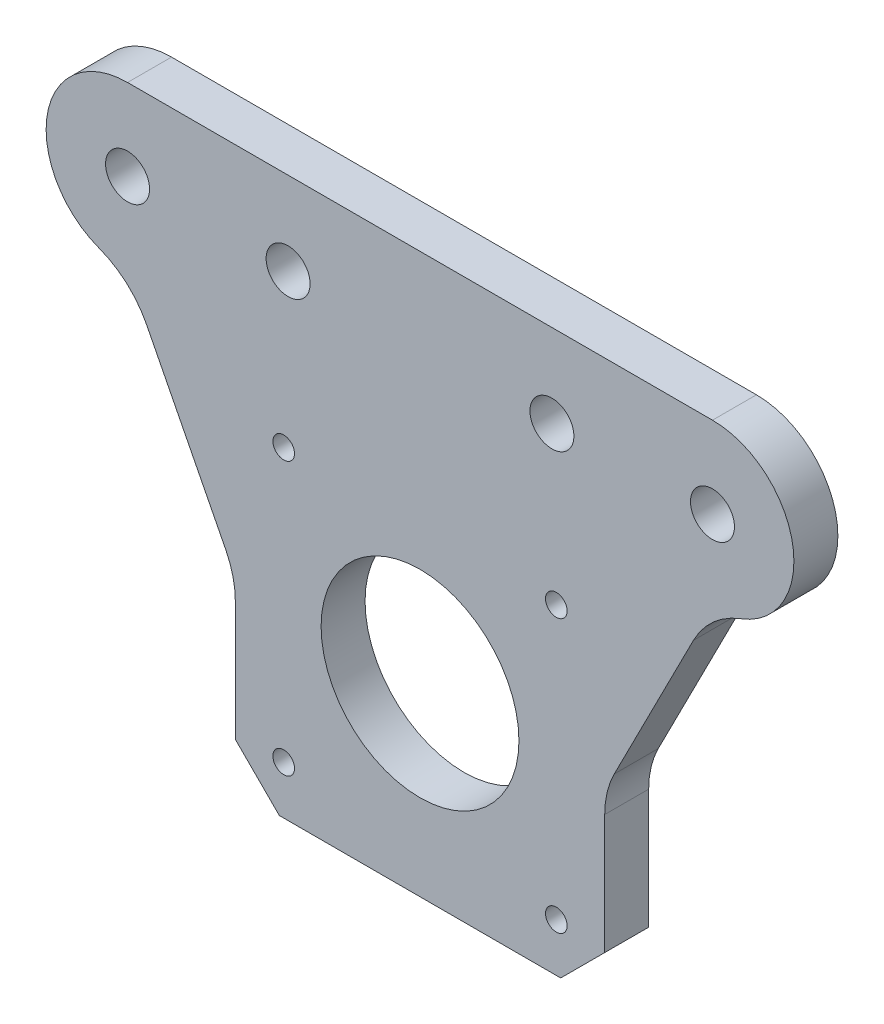
from build123d import *

# Parameters (mm, degrees)
ESQUISSE1_R             = 7.48734248
ESQUISSE1_R_2           = 2.5
BOSS_EXTRU_1_DEPTH      = 5
ESQUISSE2_R             = 1.2295
ENL_V_MAT_EXTRU_1_DEPTH = 5
CONG_2_R                = 10
CONG_3_R                = 10
ESQUISSE3_R             = 11.25
ENL_V_MAT_EXTRU_2_DEPTH = 10
CHANFREIN1_SIZE         = 5


with BuildPart() as part:
    # Esquisse1 → Boss.-Extru.1 (new body)
    with BuildSketch(Plane.XY):
        with BuildLine():
            Line((-33.258331918, 42.564920159), (33.258331918, 42.564920159))
            ThreePointArc((33.258331918, 42.564920159), (42.517839876, 33.305412201), (33.258331918, 24.045904244))
            Line((33.258331918, 24.045904244), (21, 0))
            Line((21, 0), (21, -21))
            Line((21, -21), (-21, -21))
            Line((-21, -21), (-21, 0))
            Line((-21, 0), (-33.258331918, 24.045904244))
            ThreePointArc((-33.258331918, 24.045904244), (-42.517839876, 33.305412201), (-33.258331918, 42.564920159))
        make_face()
        Circle(ESQUISSE1_R, mode=Mode.SUBTRACT)
        with Locations((-33.258331918, 33.306233754)):
            Circle(ESQUISSE1_R_2, mode=Mode.SUBTRACT)
        with Locations(Location((33.258331918, 33.306233754, 0), (0, 0, 180))):
            Circle(ESQUISSE1_R_2, mode=Mode.SUBTRACT)
        with Locations((-15, 33.108389008)):
            Circle(ESQUISSE1_R_2, mode=Mode.SUBTRACT)
        with Locations(Location((15, 33.108389008, 0), (0, 0, 180))):
            Circle(ESQUISSE1_R_2, mode=Mode.SUBTRACT)
    extrude(amount=BOSS_EXTRU_1_DEPTH)

    # Esquisse2 → Enlèv. mat.-Extru.1 (cut)
    with BuildSketch(Plane.XY.offset(5)):
        with Locations((-15.5, 15.5)):
            Circle(ESQUISSE2_R)
        with Locations((15.5, 15.5)):
            Circle(ESQUISSE2_R)
        with Locations((-15.5, -15.5)):
            Circle(ESQUISSE2_R)
        with Locations((15.5, -15.5)):
            Circle(ESQUISSE2_R)
    extrude(amount=-ENL_V_MAT_EXTRU_1_DEPTH, mode=Mode.SUBTRACT)

    # Congé2
    cong_2_edges = [part.edges().sort_by_distance(p)[0] for p in [
        (-21, 0, 2.5),
        (21, 0, 2.5),
    ]]
    fillet(cong_2_edges, radius=CONG_2_R)

    # Congé3
    cong_3_edges = [part.edges().sort_by_distance(p)[0] for p in [
        (-33.258331918, 24.045904244, 2.5),
        (33.258331918, 24.045904244, 2.5),
    ]]
    fillet(cong_3_edges, radius=CONG_3_R)

    # Esquisse3 → Enlèv. mat.-Extru.2 (cut)
    with BuildSketch(Plane.XY.offset(5)):
        Circle(ESQUISSE3_R)
    extrude(amount=-ENL_V_MAT_EXTRU_2_DEPTH, mode=Mode.SUBTRACT)

    # Chanfrein1
    chanfrein1_edges = [part.edges().sort_by_distance(p)[0] for p in [
        (21, -21, 2.5),
        (-21, -21, 2.5),
    ]]
    chamfer(chanfrein1_edges, length=CHANFREIN1_SIZE)


solid = part.part
